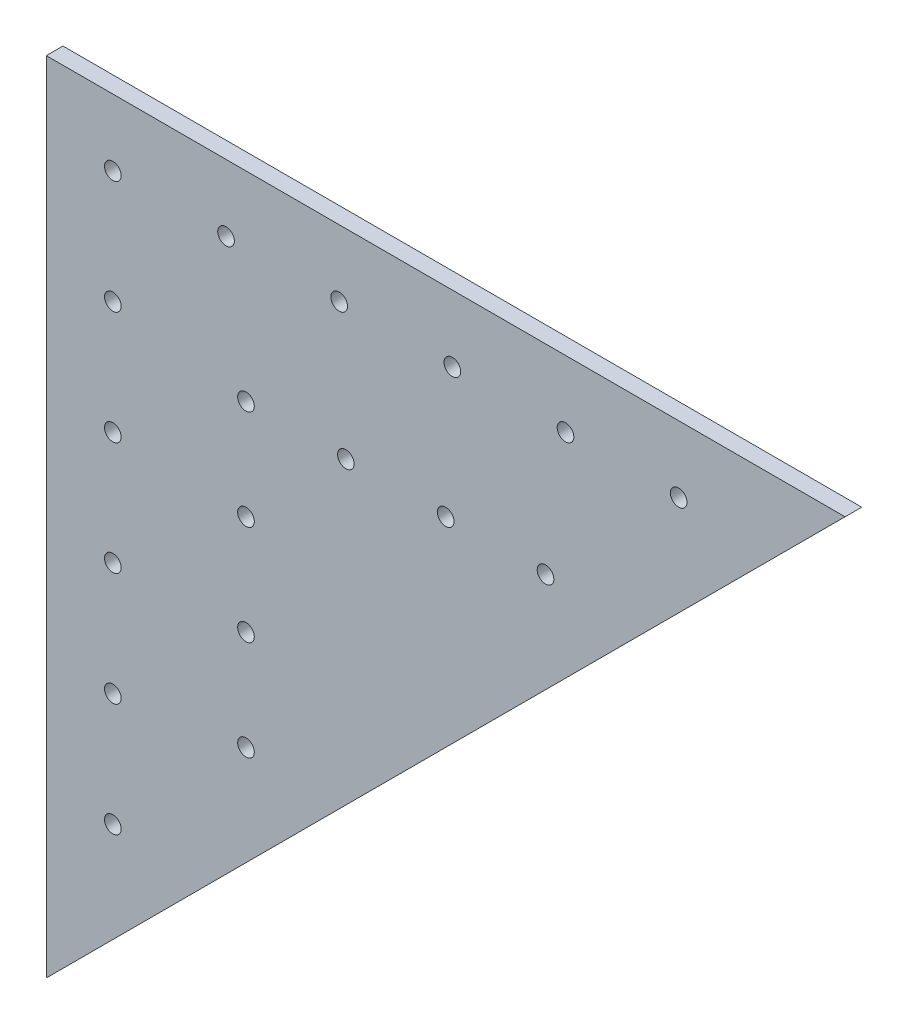
from build123d import *

# Parameters (mm, degrees)
BOSS_EXTRUDE1_DEPTH = 3.175
SKETCH2_R           = 1.5875
CUT_EXTRUDE_R_DEPTH = 216.549531721


with BuildPart() as part:
    # Sketch1 → Boss-Extrude1 (new body)
    with BuildSketch(Plane.XY):
        Polygon((0, 0), (0, 152.4), (152.4, 152.4), align=None)
    extrude(amount=BOSS_EXTRUDE1_DEPTH)

    # Sketch2 → Cut-Extrude r (cut, through all)
    with BuildSketch(Plane.XY.offset(3.175)):
        with Locations((12.7, 139.7)):
            Circle(SKETCH2_R)
        with Locations((34.29, 139.7)):
            Circle(SKETCH2_R)
        with Locations((55.88, 139.7)):
            Circle(SKETCH2_R)
        with Locations((77.47, 139.7)):
            Circle(SKETCH2_R)
        with Locations((12.7, 118.11)):
            Circle(SKETCH2_R)
        with Locations((12.7, 96.52)):
            Circle(SKETCH2_R)
        with Locations((12.7, 74.93)):
            Circle(SKETCH2_R)
        with Locations((38.1, 114.3)):
            Circle(SKETCH2_R)
        with Locations((57.15, 114.3)):
            Circle(SKETCH2_R)
        with Locations((38.1, 95.25)):
            Circle(SKETCH2_R)
        with Locations((99.06, 139.7)):
            Circle(SKETCH2_R)
        with Locations((120.65, 139.7)):
            Circle(SKETCH2_R)
        with Locations((12.7, 53.34)):
            Circle(SKETCH2_R)
        with Locations((12.7, 31.75)):
            Circle(SKETCH2_R)
        with Locations((76.2, 114.3)):
            Circle(SKETCH2_R)
        with Locations((95.25, 114.3)):
            Circle(SKETCH2_R)
        with Locations((38.1, 76.2)):
            Circle(SKETCH2_R)
        with Locations((38.1, 57.15)):
            Circle(SKETCH2_R)
    extrude(amount=-CUT_EXTRUDE_R_DEPTH, mode=Mode.SUBTRACT)


solid = part.part
